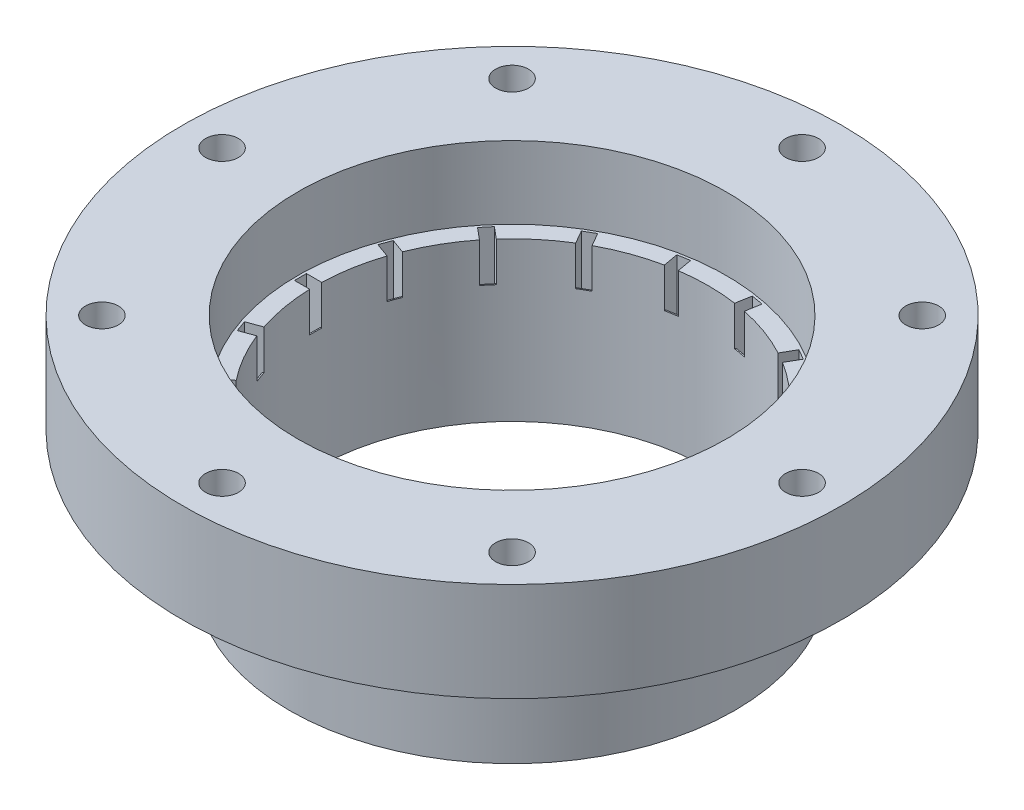
from build123d import *

# Parameters (mm, degrees)
SKETCH1_R           = 63.5
SKETCH1_R_2         = 37.846
BOSS_EXTRUDE1_DEPTH = 19.05
SKETCH2_R           = 3.175
CUT_EXTRUDE1_DEPTH  = 92.800885072
CIRPATTERN1_COUNT   = 8
BOSS_EXTRUDE2_START = -25.4
SKETCH1_3_R         = 42.926
SKETCH1_3_R_2       = 37.846
BOSS_EXTRUDE2_DEPTH = 25.4
CUT_EXTRUDE2_START  = -13.97
SKETCH3_R           = 41.275
SKETCH3_R_2         = 37.846
CUT_EXTRUDE2_DEPTH  = 13.97
SKETCH4_W           = 2.697449546
SKETCH4_H           = 2.30839954
CUT_EXTRUDE3_DEPTH  = 101.201309872
SKETCH5_W           = 2.30839954
SKETCH5_H           = 7.62
CUT_EXTRUDE4_DEPTH  = 2.54
CIRPATTERN2_COUNT   = 18


with BuildPart() as part:
    # Sketch1 → Boss-Extrude1 (new body)
    with BuildSketch(Plane(origin=(0, 0, 0), x_dir=(1, 0, 0), z_dir=(0, 1, 0))):
        Circle(SKETCH1_R)
        Circle(SKETCH1_R_2, mode=Mode.SUBTRACT)
    extrude(amount=BOSS_EXTRUDE1_DEPTH)

    # Sketch2 → Cut-Extrude1 (cut, through all)
    with BuildSketch(Plane(origin=(0, 19.05, 0), x_dir=(1, 0, 0), z_dir=(0, 1, 0))):
        with Locations((0, 55.88)):
            Circle(SKETCH2_R)
    cut_extrude1 = extrude(amount=-CUT_EXTRUDE1_DEPTH, mode=Mode.SUBTRACT)

    # CirPattern1: Cut-Extrude1 ×8 about axis
    cirpattern1_axis = Axis((0, 19.05, 0), (0, -1, 0))
    for i in range(1, CIRPATTERN1_COUNT):
        add(cut_extrude1.rotate(cirpattern1_axis, i * 360 / CIRPATTERN1_COUNT), mode=Mode.SUBTRACT)

    # Sketch1<3> → Boss-Extrude2 (add)
    with BuildSketch(Plane(origin=(0, 0, 0), x_dir=(1, 0, 0), z_dir=(0, 1, 0)).offset(BOSS_EXTRUDE2_START)):
        Circle(SKETCH1_3_R)
        Circle(SKETCH1_3_R_2, mode=Mode.SUBTRACT)
    extrude(amount=BOSS_EXTRUDE2_DEPTH)

    # Sketch3 → Cut-Extrude2 (cut)
    with BuildSketch(Plane(origin=(0, 19.05, 0), x_dir=(1, 0, 0), z_dir=(0, 1, 0)).offset(CUT_EXTRUDE2_START)):
        Circle(SKETCH3_R)
        Circle(SKETCH3_R_2, mode=Mode.SUBTRACT)
    extrude(amount=CUT_EXTRUDE2_DEPTH, mode=Mode.SUBTRACT)

    # Sketch4 → Cut-Extrude3 (cut, through all)
    with BuildSketch(Plane.XZ.offset(25.4)):
        with Locations((-39.422702208, 0)):
            Rectangle(SKETCH4_W, SKETCH4_H)
    cut_extrude3 = extrude(amount=-CUT_EXTRUDE3_DEPTH, mode=Mode.SUBTRACT)

    # Sketch5 → Cut-Extrude4 (cut)
    with BuildSketch(Plane.ZY.offset(38.073977435)):
        with Locations((0, 1.27)):
            Rectangle(SKETCH5_W, SKETCH5_H)
    cut_extrude4 = extrude(amount=-CUT_EXTRUDE4_DEPTH, mode=Mode.SUBTRACT)

    # CirPattern2: Cut-Extrude3, Cut-Extrude4 ×18 about axis
    cirpattern2_axis = Axis((0, 19.05, 0), (0, -1, 0))
    add([cut_extrude3.rotate(cirpattern2_axis, i * 360 / CIRPATTERN2_COUNT) for i in range(1, CIRPATTERN2_COUNT)], mode=Mode.SUBTRACT)
    add([cut_extrude4.rotate(cirpattern2_axis, i * 360 / CIRPATTERN2_COUNT) for i in range(1, CIRPATTERN2_COUNT)], mode=Mode.SUBTRACT)


solid = part.part
